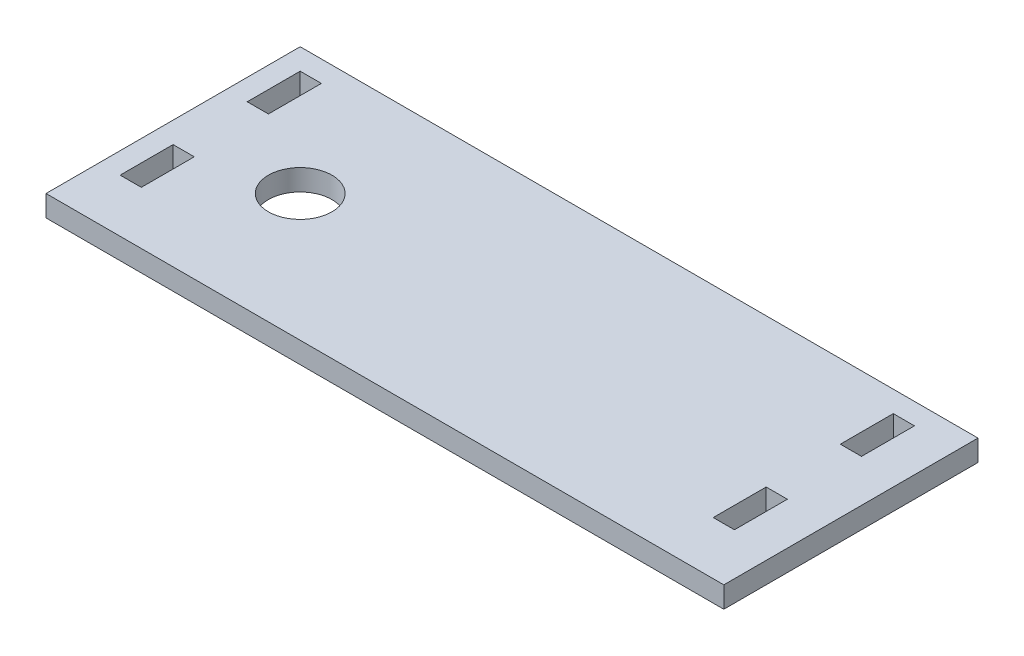
from build123d import *

# Parameters (mm, degrees)
SKETCH1_W           = 203.2
SKETCH1_H           = 76.2
SKETCH1_R           = 9.525
SKETCH1_W_2         = 6.35
SKETCH1_H_2         = 15.875
BOSS_EXTRUDE1_DEPTH = 6.35


with BuildPart() as part:
    # Sketch1 → Boss-Extrude1 (new body)
    with BuildSketch(Plane(origin=(0, 0, 0), x_dir=(1, 0, 0), z_dir=(0, 1, 0))):
        Rectangle(SKETCH1_W, SKETCH1_H)
        with Locations(Location((-63.5, 0, 0), (0, 0, 270))):
            Circle(SKETCH1_R, mode=Mode.SUBTRACT)
        with Locations((-92.075, -14.2875)):
            Rectangle(SKETCH1_W_2, SKETCH1_H_2, mode=Mode.SUBTRACT)
        with Locations((-92.075, 23.8125)):
            Rectangle(SKETCH1_W_2, SKETCH1_H_2, mode=Mode.SUBTRACT)
        with Locations((85.725, 23.8125)):
            Rectangle(SKETCH1_W_2, SKETCH1_H_2, mode=Mode.SUBTRACT)
        with Locations((85.725, -14.2875)):
            Rectangle(SKETCH1_W_2, SKETCH1_H_2, mode=Mode.SUBTRACT)
    extrude(amount=BOSS_EXTRUDE1_DEPTH)


solid = part.part
